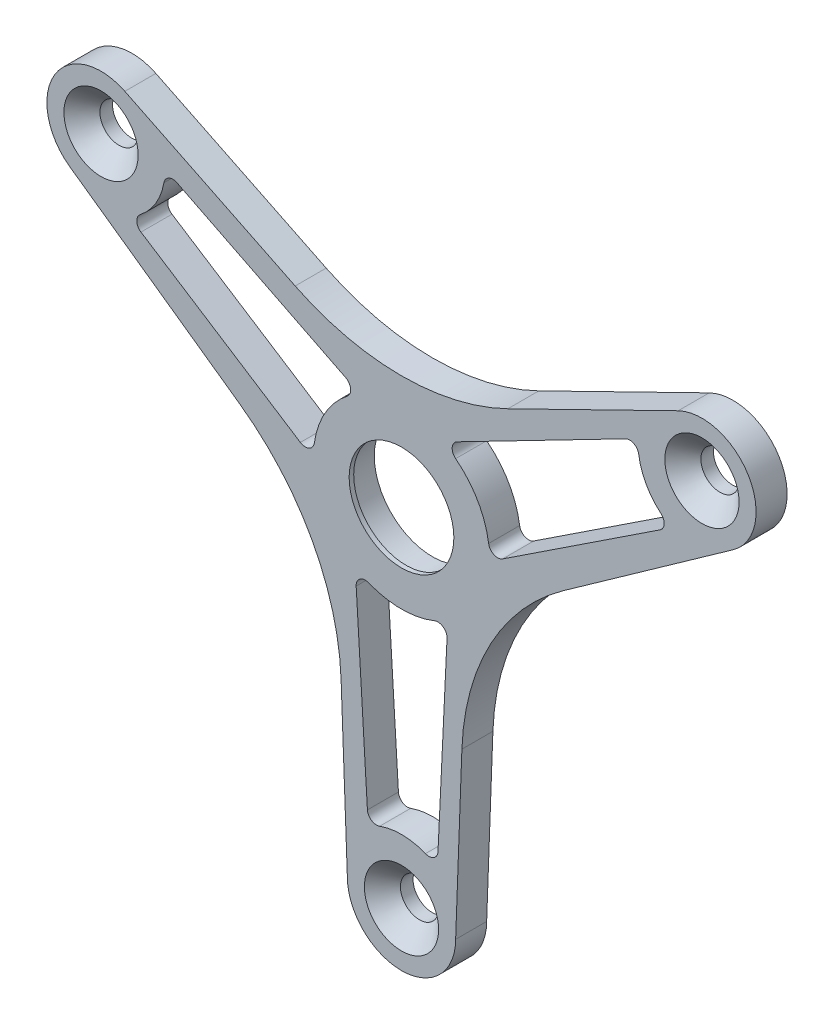
from build123d import *

# Parameters (mm, degrees)
SKETCH_1_R          = 5.935
SKETCH_1_R_2        = 2.095
SKETCH_1_R_3        = 5.74
EXTRUDE_1_DEPTH     = 3.4
SKETCH_3_R          = 6.38
CUT_EXTRUDE_1_DEPTH = 2.9
SKETCH_4_R          = 4.5
EXTRUDE_3_DEPTH     = 0.56
SKETCH_6_R          = 3.15
CUT_EXTRUDE_2_DEPTH = 0.6
SKETCH_7_R          = 3.15
CUT_EXTRUDE_3_DEPTH = 0.6
SKETCH_8_R          = 3.15
CUT_EXTRUDE_4_DEPTH = 0.6
CUT_EXTRUDE_5_DEPTH = 10


with BuildPart() as part:
    # 草图1 → 凸台-拉伸1 (new body)
    # profile 1 of 4: a face of its own
    with BuildSketch(Plane.XY):
        with Locations((-32.939276233, 19.0175)):
            Circle(SKETCH_1_R)
        with Locations((-32.939276233, 19.0175)):
            Circle(SKETCH_1_R_2, mode=Mode.SUBTRACT)
    # profile 2 of 4: a face of its own
    with BuildSketch(Plane.XY):
        with Locations((32.939276233, 19.0175)):
            Circle(SKETCH_1_R)
        with Locations((32.939276233, 19.0175)):
            Circle(SKETCH_1_R_2, mode=Mode.SUBTRACT)
    # profile 3 of 4: a face of its own
    with BuildSketch(Plane.XY):
        with BuildLine():
            Line((-11.657112974, 15.201644655), (-30.328522818, 24.347433546))
            ThreePointArc((-30.328522818, 24.347433546), (-27.903452243, 22.158312274), (-27.004276233, 19.0175))
            ThreePointArc((-27.004276233, 19.0175), (-30.213751559, 13.745333439), (-36.370995778, 14.175235451))
            Line((-36.370995778, 14.175235451), (-17.779369394, 0.999324265))
            ThreePointArc((-17.779369394, 0.999324265), (-9.792356792, -8.015833705), (-6.620498611, -19.634988545))
            Line((-6.620498611, -19.634988545), (-5.935, -38.035))
            ThreePointArc((-5.935, -38.035), (0, -32.1), (5.935, -38.035))
            Line((5.935, -38.035), (6.620498611, -19.634988545))
            ThreePointArc((6.620498611, -19.634988545), (9.792356792, -8.015833705), (17.779369394, 0.999324265))
            Line((17.779369394, 0.999324265), (36.370995778, 14.175235451))
            ThreePointArc((36.370995778, 14.175235451), (27.836639672, 15.986439933), (30.328522818, 24.347433546))
            Line((30.328522818, 24.347433546), (11.657112974, 15.201644655))
            ThreePointArc((11.657112974, 15.201644655), (0, 12.5), (-11.657112974, 15.201644655))
        make_face()
        Circle(SKETCH_1_R_3, mode=Mode.SUBTRACT)
    # profile 4 of 4: a face of its own
    with BuildSketch(Plane.XY):
        with Locations((0, -38.035)):
            Circle(SKETCH_1_R)
        with Locations((0, -38.035)):
            Circle(SKETCH_1_R_2, mode=Mode.SUBTRACT)
    extrude(amount=EXTRUDE_1_DEPTH)

    # 草图3 → 切除-拉伸1 (cut)
    with BuildSketch(Plane(origin=(0, 0, 0), x_dir=(-1, 0, 0), z_dir=(0, 0, -1))):
        Circle(SKETCH_3_R)
    extrude(amount=-CUT_EXTRUDE_1_DEPTH, mode=Mode.SUBTRACT)

    # 草图4 → 凸台-拉伸3 (add)
    with BuildSketch(Plane(origin=(0, 0, 0), x_dir=(-1, 0, 0), z_dir=(0, 0, -1))):
        with Locations(Location((0, -38.035, 0), (0, 0, 180))):
            Circle(SKETCH_4_R)
        with Locations(Location((32.939276233, 19.0175, 0), (0, 0, 180))):
            Circle(SKETCH_4_R)
        with Locations(Location((-32.939276233, 19.0175, 0), (0, 0, 180))):
            Circle(SKETCH_4_R)
    extrude(amount=EXTRUDE_3_DEPTH)

    # 草图6 → 切除-拉伸2 (cut)
    with BuildSketch(Plane(origin=(0, 0, -0.56), x_dir=(-1, 0, 0), z_dir=(0, 0, -1))):
        with Locations((0, -38.035)):
            Circle(SKETCH_6_R)
    extrude(amount=-CUT_EXTRUDE_2_DEPTH, mode=Mode.SUBTRACT)

    # 草图7 → 切除-拉伸3 (cut)
    with BuildSketch(Plane(origin=(0, 0, -0.56), x_dir=(-1, 0, 0), z_dir=(0, 0, -1))):
        with Locations((-32.939276233, 19.0175)):
            Circle(SKETCH_7_R)
    extrude(amount=-CUT_EXTRUDE_3_DEPTH, mode=Mode.SUBTRACT)

    # 草图8 → 切除-拉伸4 (cut)
    with BuildSketch(Plane(origin=(0, 0, -0.56), x_dir=(-1, 0, 0), z_dir=(0, 0, -1))):
        with Locations((32.939276233, 19.0175)):
            Circle(SKETCH_8_R)
    extrude(amount=-CUT_EXTRUDE_4_DEPTH, mode=Mode.SUBTRACT)

    # 草图9 → 切除-旋转1 (revolve, cut)
    with BuildSketch(Plane(origin=(0, 19.0175, 0), x_dir=(-1, 0, 0), z_dir=(0, -1, 0))):
        Polygon((35.034276233, -3.4), (35.034276233, -1.425), (37.009276233, -3.4), align=None)
    revolve(axis=Axis((-32.939276233, 19.0175, 3.4), (0, 0, -1)), mode=Mode.SUBTRACT)

    # 草图10 → 切除-旋转2 (revolve, cut)
    with BuildSketch(Plane(origin=(16.469638116, -9.50875, 0), x_dir=(0, 0, 1), z_dir=(-0.8660254037844397, 0.49999999999999806, 0)), mode=Mode.PRIVATE) as cut_revolve_2_sk:
        Polygon((3.4, 35.034276233), (3.4, 37.009276233), (1.425, 35.034276233), align=None)
    revolve(cut_revolve_2_sk.sketch.rotate(Axis((32.939276233, 19.0175, 3.4), (0, 0, -1)), 240), axis=Axis((32.939276233, 19.0175, 3.4), (0, 0, -1)), mode=Mode.SUBTRACT)

    # 草图11 → 切除-旋转3 (revolve, cut)
    with BuildSketch(Plane(origin=(16.469638116, -9.50875, 0), x_dir=(0, 0, 1), z_dir=(-0.8660254037844397, 0.49999999999999806, 0)), mode=Mode.PRIVATE) as cut_revolve_3_sk:
        Polygon((3.4, -30.844276233), (3.4, -28.869276233), (1.425, -30.844276233), align=None)
    revolve(cut_revolve_3_sk.sketch.rotate(Axis((0, -38.035, 3.4), (0, 0, -1)), 240), axis=Axis((0, -38.035, 3.4), (0, 0, -1)), mode=Mode.SUBTRACT)

    # 草图12 → 切除-拉伸5 (cut)
    with BuildSketch(Plane(origin=(0, 0, 0), x_dir=(-1, 0, 0), z_dir=(0, 0, -1))):
        with BuildLine():
            Line((-4.991404318, -9.920918283), (-4.002436423, -30.667860961))
            ThreePointArc((-4.002436423, -30.667860961), (-3.542480946, -31.462610037), (-2.628124289, -31.547091036))
            ThreePointArc((-2.628124289, -31.547091036), (-0.124699507, -31.0361108), (2.395338905, -31.457587778))
            ThreePointArc((2.395338905, -31.457587778), (3.286322012, -31.353916504), (3.73574796, -30.577633728))
            Line((3.73574796, -30.577633728), (4.96942943, -9.941577808))
            ThreePointArc((4.96942943, -9.941577808), (4.555657168, -9.070468591), (3.598327924, -8.954023462))
            ThreePointArc((3.598327924, -8.954023462), (-0.010417716, -9.649994377), (-3.617652266, -8.946233402))
            ThreePointArc((-3.617652266, -8.946233402), (-4.57119236, -9.057730973), (-4.991404318, -9.920918283))
        make_face()
        with BuildLine():
            Line((-6.096065103, 9.283142082), (-24.55792846, 18.8001421))
            ThreePointArc((-24.55792846, 18.8001421), (-25.476179088, 18.79918351), (-26.006520108, 18.049567917))
            ThreePointArc((-26.006520108, 18.049567917), (-26.815710634, 15.626048341), (-28.44073961, 13.654369547))
            ThreePointArc((-28.44073961, 13.654369547), (-28.796449207, 12.830919904), (-28.348881576, 12.053564228))
            Line((-28.348881576, 12.053564228), (-11.09437365, 0.667136775))
            ThreePointArc((-11.09437365, 0.667136775), (-10.133084808, 0.589919457), (-9.553575746, 1.360768338))
            ThreePointArc((-9.553575746, 1.360768338), (-8.351931419, 4.834019195), (-5.938839262, 7.606095465))
            ThreePointArc((-5.938839262, 7.606095465), (-5.558628943, 8.487634196), (-6.096065103, 9.283142082))
        make_face()
        with BuildLine():
            Line((11.087469421, 0.637776201), (28.560364883, 11.867718861))
            ThreePointArc((28.560364883, 11.867718861), (29.018660034, 12.663426527), (28.634644397, 13.49752312))
            ThreePointArc((28.634644397, 13.49752312), (26.940410141, 15.410062459), (26.045400706, 17.803218231))
            ThreePointArc((26.045400706, 17.803218231), (25.510127195, 18.5229966), (24.613133616, 18.5240695))
            Line((24.613133616, 18.5240695), (6.12494422, 9.274441032))
            ThreePointArc((6.12494422, 9.274441032), (5.57742764, 8.480549134), (5.955247822, 7.593255124))
            ThreePointArc((5.955247822, 7.593255124), (8.362349135, 4.815975182), (9.556491527, 1.340137937))
            ThreePointArc((9.556491527, 1.340137937), (10.129821304, 0.570096777), (11.087469421, 0.637776201))
        make_face()
    extrude(amount=-CUT_EXTRUDE_5_DEPTH, mode=Mode.SUBTRACT)


solid = part.part
